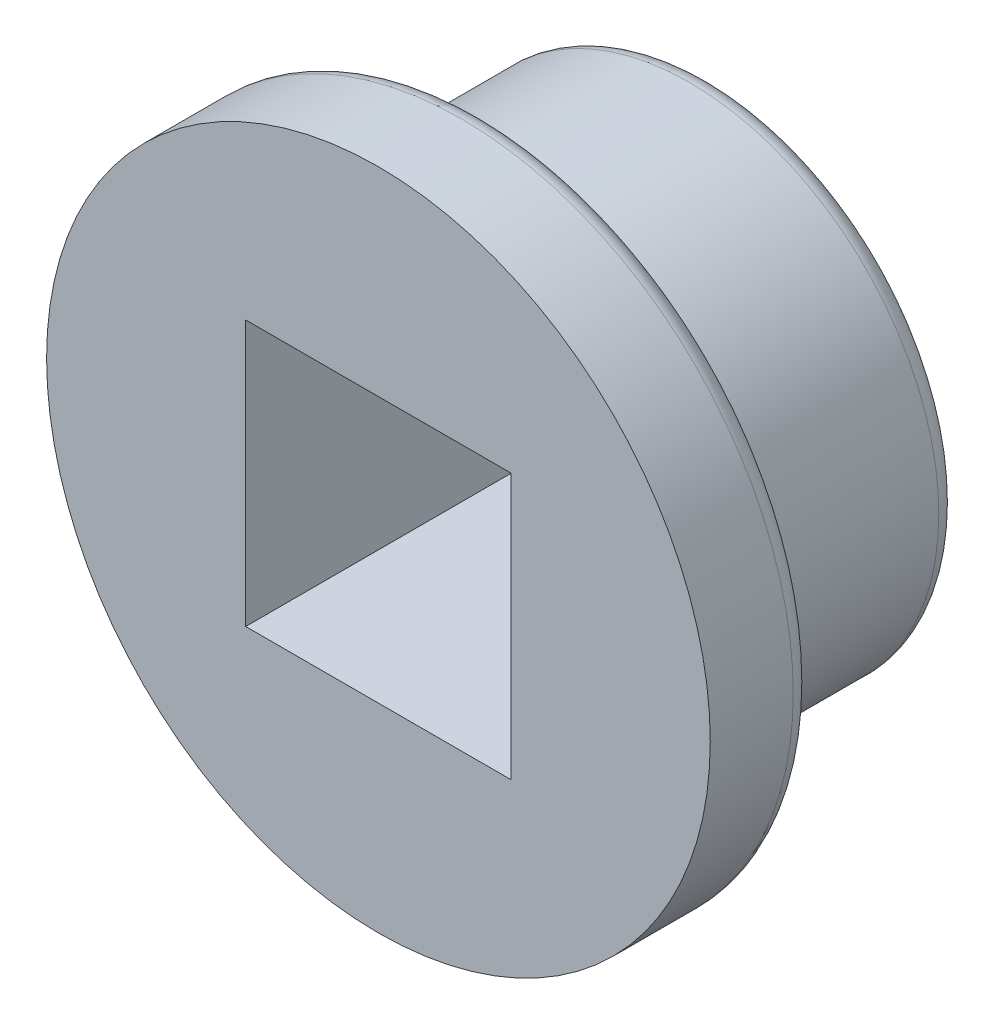
from build123d import *

# Parameters (mm, degrees)
SKETCH1_R           = 6.01
SKETCH1_W           = 6.4
SKETCH1_H           = 6.4
BOSS_EXTRUDE1_DEPTH = 5.5
SKETCH1_3_R         = 8
SKETCH1_3_W         = 6.4
SKETCH1_3_H         = 6.4
BOSS_EXTRUDE2_DEPTH = 2.5
FILLET1_R           = 0.5


with BuildPart() as part:
    # Sketch1 → Boss-Extrude1 (new body)
    with BuildSketch(Plane.XY):
        Circle(SKETCH1_R)
        Rectangle(SKETCH1_W, SKETCH1_H, mode=Mode.SUBTRACT)
    extrude(amount=-BOSS_EXTRUDE1_DEPTH)

    # Sketch1<3> → Boss-Extrude2 (add)
    with BuildSketch(Plane.XY):
        Circle(SKETCH1_3_R)
        Rectangle(SKETCH1_3_W, SKETCH1_3_H, mode=Mode.SUBTRACT)
    extrude(amount=BOSS_EXTRUDE2_DEPTH)

    # Fillet1
    fillet1_edges = [part.edges().sort_by_distance(p)[0] for p in [
        (-8, 0, 0),
        (-6.01, 0, -5.5),
    ]]
    fillet(fillet1_edges, radius=FILLET1_R)


solid = part.part
